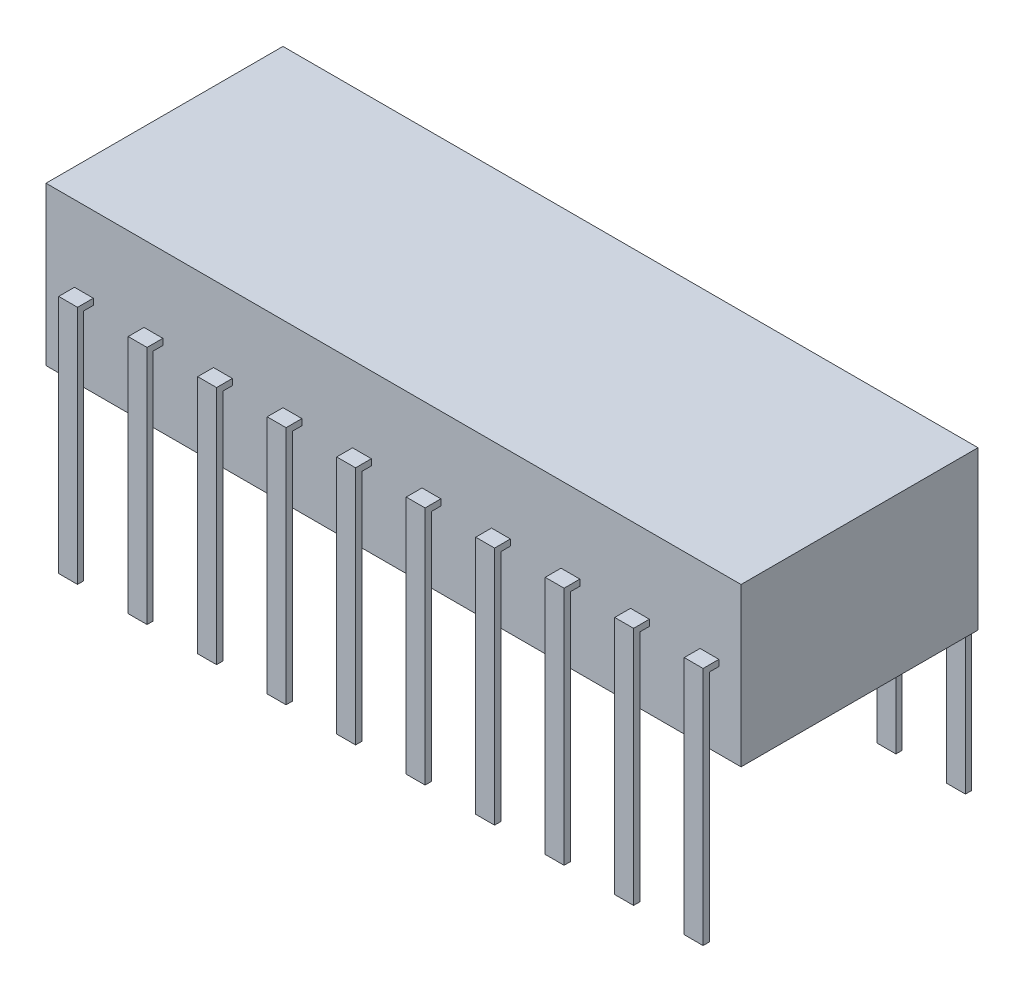
from build123d import *

# Parameters (mm, degrees)
SKETCH2_W                = 22
SKETCH2_H                = 5
BOSS_EXTRUDE2_DEPTH      = 7.5
SKETCH16_W               = 0.596885676
SKETCH16_H               = 0.19726192
BOSS_EXTRUDE6_DEPTH      = 0.5
SKETCH17_W               = 0.596885676
SKETCH17_H               = 0.196118077
BOSS_EXTRUDE7_DEPTH      = 7.4
LPATTERN2_COUNT          = 10
LPATTERN2_PITCH          = 2.2
MIRROR1_COPY_1_SKETCH_W  = 0.596885676
MIRROR1_COPY_1_SKETCH_H  = 0.19726192
MIRROR1_COPY_1_DEPTH     = 0.5
MIRROR1_COPY_2_SKETCH_W  = 0.596885676
MIRROR1_COPY_2_SKETCH_H  = 0.19726192
MIRROR1_COPY_2_DEPTH     = 0.5
MIRROR1_COPY_3_SKETCH_W  = 0.596885676
MIRROR1_COPY_3_SKETCH_H  = 0.19726192
MIRROR1_COPY_3_DEPTH     = 0.5
MIRROR1_COPY_4_SKETCH_W  = 0.596885676
MIRROR1_COPY_4_SKETCH_H  = 0.19726192
MIRROR1_COPY_4_DEPTH     = 0.5
MIRROR1_COPY_5_SKETCH_W  = 0.596885676
MIRROR1_COPY_5_SKETCH_H  = 0.19726192
MIRROR1_COPY_5_DEPTH     = 0.5
MIRROR1_COPY_6_SKETCH_W  = 0.596885676
MIRROR1_COPY_6_SKETCH_H  = 0.19726192
MIRROR1_COPY_6_DEPTH     = 0.5
MIRROR1_COPY_7_SKETCH_W  = 0.596885676
MIRROR1_COPY_7_SKETCH_H  = 0.19726192
MIRROR1_COPY_7_DEPTH     = 0.5
MIRROR1_COPY_8_SKETCH_W  = 0.596885676
MIRROR1_COPY_8_SKETCH_H  = 0.19726192
MIRROR1_COPY_8_DEPTH     = 0.5
MIRROR1_COPY_9_SKETCH_W  = 0.596885676
MIRROR1_COPY_9_SKETCH_H  = 0.19726192
MIRROR1_COPY_9_DEPTH     = 0.5
MIRROR1_COPY_10_SKETCH_W = 0.596885676
MIRROR1_COPY_10_SKETCH_H = 0.196118077
MIRROR1_COPY_10_DEPTH    = 7.4
MIRROR1_COPY_11_SKETCH_W = 0.596885676
MIRROR1_COPY_11_SKETCH_H = 0.196118077
MIRROR1_COPY_11_DEPTH    = 7.4
MIRROR1_COPY_12_SKETCH_W = 0.596885676
MIRROR1_COPY_12_SKETCH_H = 0.196118077
MIRROR1_COPY_12_DEPTH    = 7.4
MIRROR1_COPY_13_SKETCH_W = 0.596885676
MIRROR1_COPY_13_SKETCH_H = 0.196118077
MIRROR1_COPY_13_DEPTH    = 7.4
MIRROR1_COPY_14_SKETCH_W = 0.596885676
MIRROR1_COPY_14_SKETCH_H = 0.196118077
MIRROR1_COPY_14_DEPTH    = 7.4
MIRROR1_COPY_15_SKETCH_W = 0.596885676
MIRROR1_COPY_15_SKETCH_H = 0.196118077
MIRROR1_COPY_15_DEPTH    = 7.4
MIRROR1_COPY_16_SKETCH_W = 0.596885676
MIRROR1_COPY_16_SKETCH_H = 0.196118077
MIRROR1_COPY_16_DEPTH    = 7.4
MIRROR1_COPY_17_SKETCH_W = 0.596885676
MIRROR1_COPY_17_SKETCH_H = 0.196118077
MIRROR1_COPY_17_DEPTH    = 7.4
MIRROR1_COPY_18_SKETCH_W = 0.596885676
MIRROR1_COPY_18_SKETCH_H = 0.196118077
MIRROR1_COPY_18_DEPTH    = 7.4


with BuildPart() as part:
    # Sketch2 → Boss-Extrude2 (new body)
    with BuildSketch(Plane(origin=(0, 5.922936542, 0), x_dir=(1, 0, 0), z_dir=(0, 0, 1))):
        with Locations((11, 2.5)):
            Rectangle(SKETCH2_W, SKETCH2_H)
    extrude(amount=BOSS_EXTRUDE2_DEPTH)

    # Sketch16 → Boss-Extrude6 (add)
    with BuildSketch(Plane.XY):
        with Locations((21, 8.422)):
            Rectangle(SKETCH16_W, SKETCH16_H)
    boss_extrude6 = extrude(amount=-BOSS_EXTRUDE6_DEPTH)

    # Sketch17 → Boss-Extrude7 (add)
    with BuildSketch(Plane.XZ.offset(-8.32336904)):
        with Locations((21, -0.401940962)):
            Rectangle(SKETCH17_W, SKETCH17_H)
    boss_extrude7 = extrude(amount=BOSS_EXTRUDE7_DEPTH)

    # LPattern2: Boss-Extrude6, Boss-Extrude7 ×10
    with Locations(*[(-i * LPATTERN2_PITCH, 0, 0) for i in range(1, LPATTERN2_COUNT)]):
        add(boss_extrude6)
        add(boss_extrude7)

    # Mirror1: Boss-Extrude6, Boss-Extrude7 across plane
    add(boss_extrude6.mirror(Plane(origin=(0, 0, 3.75), x_dir=(1, 0, 0), z_dir=(0, 0, -1))))
    add(boss_extrude7.mirror(Plane(origin=(0, 0, 3.75), x_dir=(1, 0, 0), z_dir=(0, 0, -1))))

    # Mirror1 copy 1 sketch → Mirror1 copy 1 (add)
    with BuildSketch(Plane(origin=(-2.2, 0, 7.5), x_dir=(1, 0, 0), z_dir=(0, 0, -1))):
        with Locations((21, -8.422)):
            Rectangle(MIRROR1_COPY_1_SKETCH_W, MIRROR1_COPY_1_SKETCH_H)
    extrude(amount=-MIRROR1_COPY_1_DEPTH)

    # Mirror1 copy 2 sketch → Mirror1 copy 2 (add)
    with BuildSketch(Plane(origin=(-4.4, 0, 7.5), x_dir=(1, 0, 0), z_dir=(0, 0, -1))):
        with Locations((21, -8.422)):
            Rectangle(MIRROR1_COPY_2_SKETCH_W, MIRROR1_COPY_2_SKETCH_H)
    extrude(amount=-MIRROR1_COPY_2_DEPTH)

    # Mirror1 copy 3 sketch → Mirror1 copy 3 (add)
    with BuildSketch(Plane(origin=(-6.6, 0, 7.5), x_dir=(1, 0, 0), z_dir=(0, 0, -1))):
        with Locations((21, -8.422)):
            Rectangle(MIRROR1_COPY_3_SKETCH_W, MIRROR1_COPY_3_SKETCH_H)
    extrude(amount=-MIRROR1_COPY_3_DEPTH)

    # Mirror1 copy 4 sketch → Mirror1 copy 4 (add)
    with BuildSketch(Plane(origin=(-8.8, 0, 7.5), x_dir=(1, 0, 0), z_dir=(0, 0, -1))):
        with Locations((21, -8.422)):
            Rectangle(MIRROR1_COPY_4_SKETCH_W, MIRROR1_COPY_4_SKETCH_H)
    extrude(amount=-MIRROR1_COPY_4_DEPTH)

    # Mirror1 copy 5 sketch → Mirror1 copy 5 (add)
    with BuildSketch(Plane(origin=(-11, 0, 7.5), x_dir=(1, 0, 0), z_dir=(0, 0, -1))):
        with Locations((21, -8.422)):
            Rectangle(MIRROR1_COPY_5_SKETCH_W, MIRROR1_COPY_5_SKETCH_H)
    extrude(amount=-MIRROR1_COPY_5_DEPTH)

    # Mirror1 copy 6 sketch → Mirror1 copy 6 (add)
    with BuildSketch(Plane(origin=(-13.2, 0, 7.5), x_dir=(1, 0, 0), z_dir=(0, 0, -1))):
        with Locations((21, -8.422)):
            Rectangle(MIRROR1_COPY_6_SKETCH_W, MIRROR1_COPY_6_SKETCH_H)
    extrude(amount=-MIRROR1_COPY_6_DEPTH)

    # Mirror1 copy 7 sketch → Mirror1 copy 7 (add)
    with BuildSketch(Plane(origin=(-15.4, 0, 7.5), x_dir=(1, 0, 0), z_dir=(0, 0, -1))):
        with Locations((21, -8.422)):
            Rectangle(MIRROR1_COPY_7_SKETCH_W, MIRROR1_COPY_7_SKETCH_H)
    extrude(amount=-MIRROR1_COPY_7_DEPTH)

    # Mirror1 copy 8 sketch → Mirror1 copy 8 (add)
    with BuildSketch(Plane(origin=(-17.6, 0, 7.5), x_dir=(1, 0, 0), z_dir=(0, 0, -1))):
        with Locations((21, -8.422)):
            Rectangle(MIRROR1_COPY_8_SKETCH_W, MIRROR1_COPY_8_SKETCH_H)
    extrude(amount=-MIRROR1_COPY_8_DEPTH)

    # Mirror1 copy 9 sketch → Mirror1 copy 9 (add)
    with BuildSketch(Plane(origin=(-19.8, 0, 7.5), x_dir=(1, 0, 0), z_dir=(0, 0, -1))):
        with Locations((21, -8.422)):
            Rectangle(MIRROR1_COPY_9_SKETCH_W, MIRROR1_COPY_9_SKETCH_H)
    extrude(amount=-MIRROR1_COPY_9_DEPTH)

    # Mirror1 copy 10 sketch → Mirror1 copy 10 (add)
    with BuildSketch(Plane(origin=(-2.2, 8.32336904, 7.5), x_dir=(1, 0, 0), z_dir=(0, -1, 0))):
        with Locations((21, 0.401940962)):
            Rectangle(MIRROR1_COPY_10_SKETCH_W, MIRROR1_COPY_10_SKETCH_H)
    extrude(amount=MIRROR1_COPY_10_DEPTH)

    # Mirror1 copy 11 sketch → Mirror1 copy 11 (add)
    with BuildSketch(Plane(origin=(-4.4, 8.32336904, 7.5), x_dir=(1, 0, 0), z_dir=(0, -1, 0))):
        with Locations((21, 0.401940962)):
            Rectangle(MIRROR1_COPY_11_SKETCH_W, MIRROR1_COPY_11_SKETCH_H)
    extrude(amount=MIRROR1_COPY_11_DEPTH)

    # Mirror1 copy 12 sketch → Mirror1 copy 12 (add)
    with BuildSketch(Plane(origin=(-6.6, 8.32336904, 7.5), x_dir=(1, 0, 0), z_dir=(0, -1, 0))):
        with Locations((21, 0.401940962)):
            Rectangle(MIRROR1_COPY_12_SKETCH_W, MIRROR1_COPY_12_SKETCH_H)
    extrude(amount=MIRROR1_COPY_12_DEPTH)

    # Mirror1 copy 13 sketch → Mirror1 copy 13 (add)
    with BuildSketch(Plane(origin=(-8.8, 8.32336904, 7.5), x_dir=(1, 0, 0), z_dir=(0, -1, 0))):
        with Locations((21, 0.401940962)):
            Rectangle(MIRROR1_COPY_13_SKETCH_W, MIRROR1_COPY_13_SKETCH_H)
    extrude(amount=MIRROR1_COPY_13_DEPTH)

    # Mirror1 copy 14 sketch → Mirror1 copy 14 (add)
    with BuildSketch(Plane(origin=(-11, 8.32336904, 7.5), x_dir=(1, 0, 0), z_dir=(0, -1, 0))):
        with Locations((21, 0.401940962)):
            Rectangle(MIRROR1_COPY_14_SKETCH_W, MIRROR1_COPY_14_SKETCH_H)
    extrude(amount=MIRROR1_COPY_14_DEPTH)

    # Mirror1 copy 15 sketch → Mirror1 copy 15 (add)
    with BuildSketch(Plane(origin=(-13.2, 8.32336904, 7.5), x_dir=(1, 0, 0), z_dir=(0, -1, 0))):
        with Locations((21, 0.401940962)):
            Rectangle(MIRROR1_COPY_15_SKETCH_W, MIRROR1_COPY_15_SKETCH_H)
    extrude(amount=MIRROR1_COPY_15_DEPTH)

    # Mirror1 copy 16 sketch → Mirror1 copy 16 (add)
    with BuildSketch(Plane(origin=(-15.4, 8.32336904, 7.5), x_dir=(1, 0, 0), z_dir=(0, -1, 0))):
        with Locations((21, 0.401940962)):
            Rectangle(MIRROR1_COPY_16_SKETCH_W, MIRROR1_COPY_16_SKETCH_H)
    extrude(amount=MIRROR1_COPY_16_DEPTH)

    # Mirror1 copy 17 sketch → Mirror1 copy 17 (add)
    with BuildSketch(Plane(origin=(-17.6, 8.32336904, 7.5), x_dir=(1, 0, 0), z_dir=(0, -1, 0))):
        with Locations((21, 0.401940962)):
            Rectangle(MIRROR1_COPY_17_SKETCH_W, MIRROR1_COPY_17_SKETCH_H)
    extrude(amount=MIRROR1_COPY_17_DEPTH)

    # Mirror1 copy 18 sketch → Mirror1 copy 18 (add)
    with BuildSketch(Plane(origin=(-19.8, 8.32336904, 7.5), x_dir=(1, 0, 0), z_dir=(0, -1, 0))):
        with Locations((21, 0.401940962)):
            Rectangle(MIRROR1_COPY_18_SKETCH_W, MIRROR1_COPY_18_SKETCH_H)
    extrude(amount=MIRROR1_COPY_18_DEPTH)


solid = part.part
